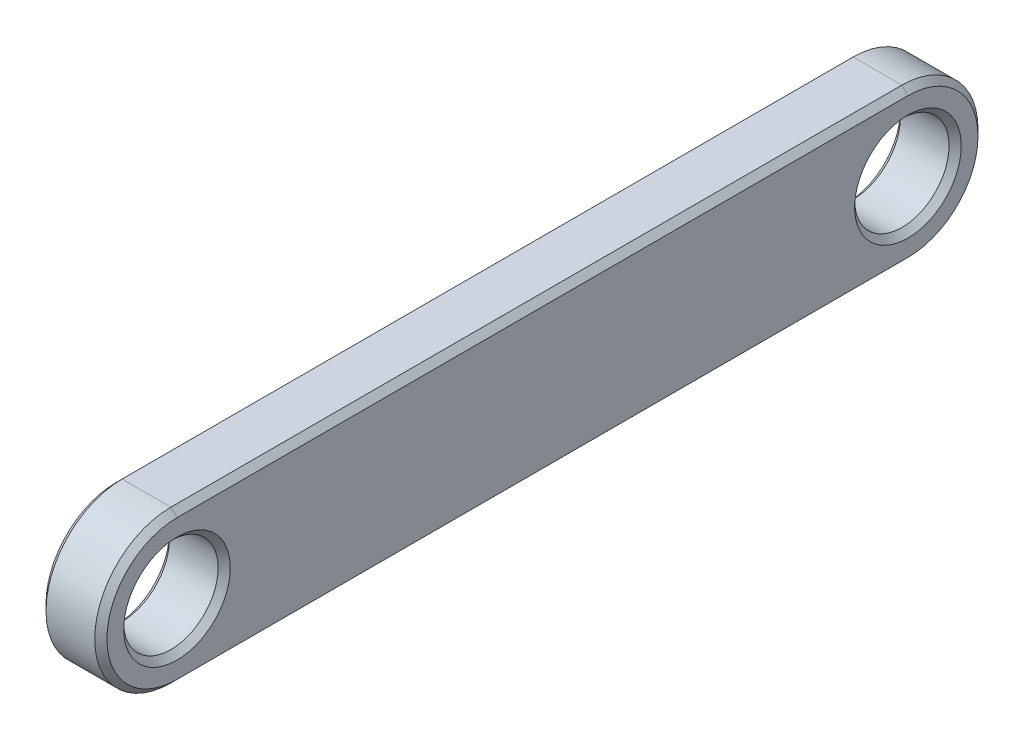
from build123d import *

# Parameters (mm, degrees)
SKETCH1_R           = 1.55
BOSS_EXTRUDE1_DEPTH = 2
CHAMFER1_SIZE       = 0.2


with BuildPart() as part:
    # Sketch1 → Boss-Extrude1 (new body)
    with BuildSketch(Plane(origin=(0, 0, 0), x_dir=(0, 0, -1), z_dir=(1, 0, 0))):
        with BuildLine():
            Line((-12, 2.5), (12, 2.5))
            ThreePointArc((12, 2.5), (14.5, 0), (12, -2.5))
            Line((12, -2.5), (-12, -2.5))
            ThreePointArc((-12, -2.5), (-14.5, 0), (-12, 2.5))
        make_face()
        with Locations((-12, 0)):
            Circle(SKETCH1_R, mode=Mode.SUBTRACT)
        with Locations((12, 0)):
            Circle(SKETCH1_R, mode=Mode.SUBTRACT)
    extrude(amount=BOSS_EXTRUDE1_DEPTH)

    # Chamfer1
    chamfer1_edges = [part.edges().sort_by_distance(p)[0] for p in [
        (0, 0, 13.55),
        (2, 0, 13.55),
        (2, 0, -14.5),
        (0, 0, -10.45),
        (2, 0, -10.45),
        (2, 2.5, 0),
        (2, 0, 14.5),
        (0, 2.5, 0),
        (0, 0, -14.5),
        (0, -2.5, 0),
        (0, 0, 14.5),
        (2, -2.5, 0),
    ]]
    chamfer(chamfer1_edges, length=CHAMFER1_SIZE)


solid = part.part
